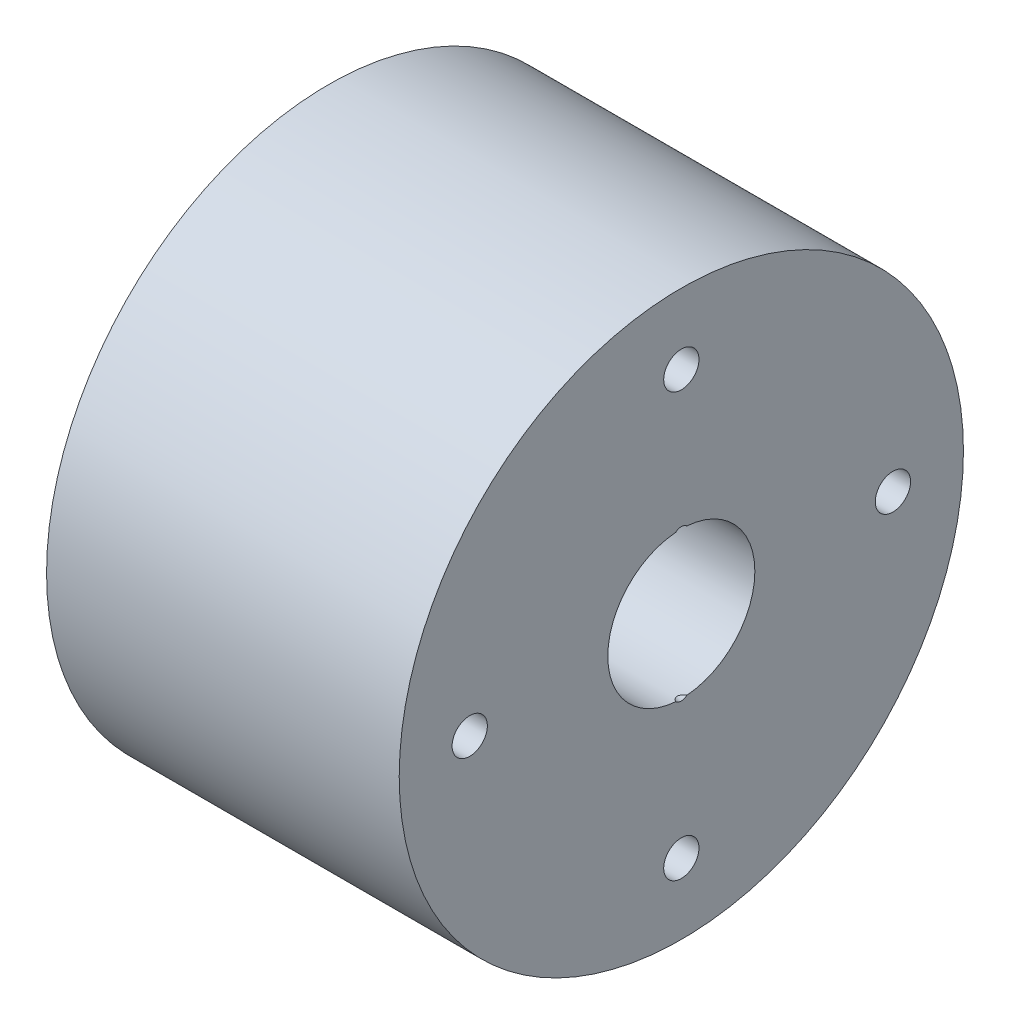
from build123d import *

# Parameters (mm, degrees)
SKETCH1_R                                  = 40
BOSS_EXTRUDE1_DEPTH                        = 50
SKETCH2_R                                  = 10.425
CUT_EXTRUDE1_DEPTH                         = 30
SKETCH3_R                                  = 20
SKETCH3_R_2                                = 10
CUT_EXTRUDE2_DEPTH                         = 5
SKETCH4_R                                  = 0.5
CUT_EXTRUDE3_DEPTH                         = 76.498344353
SKETCH5_R                                  = 2.5
CUT_EXTRUDE4_DEPTH                         = 76.498344353
CUT_EXTRUDE5_START                         = -49.839677
SKETCH7_R                                  = 1.25
CUT_EXTRUDE5_DEPTH                         = 50.817776
MIRROR1_START                              = -49.839677
MIRROR1_AT_THE_SECOND_PLANE_COPY_1_SKETC_R = 1.25
MIRROR1_AT_THE_SECOND_PLANE_COPY_1_DEPTH   = 50.817776


with BuildPart() as part:
    # Sketch1 → Boss-Extrude1 (new body)
    with BuildSketch(Plane(origin=(0, 0, 0), x_dir=(0, 0, -1), z_dir=(1, 0, 0))):
        Circle(SKETCH1_R)
    extrude(amount=BOSS_EXTRUDE1_DEPTH)

    # Sketch2 → Cut-Extrude1 (cut)
    with BuildSketch(Plane(origin=(50, 0, 0), x_dir=(0, 0, -1), z_dir=(1, 0, 0))):
        Circle(SKETCH2_R)
    extrude(amount=-CUT_EXTRUDE1_DEPTH, mode=Mode.SUBTRACT)

    # Sketch3 → Cut-Extrude2 (cut)
    with BuildSketch(Plane.ZY):
        Circle(SKETCH3_R)
        Circle(SKETCH3_R_2, mode=Mode.SUBTRACT)
    extrude(amount=-CUT_EXTRUDE2_DEPTH, mode=Mode.SUBTRACT)

    # Sketch4 → Cut-Extrude3 (cut, through all)
    with BuildSketch(Plane.ZY):
        Circle(SKETCH4_R)
    extrude(amount=-CUT_EXTRUDE3_DEPTH, mode=Mode.SUBTRACT)

    # Sketch5 → Cut-Extrude4 (cut, through all)
    with BuildSketch(Plane.ZY):
        with Locations((0, 30)):
            Circle(SKETCH5_R)
        with Locations((30, 0)):
            Circle(SKETCH5_R)
        with Locations((0, -30)):
            Circle(SKETCH5_R)
        with Locations((-30, 0)):
            Circle(SKETCH5_R)
    extrude(amount=-CUT_EXTRUDE4_DEPTH, mode=Mode.SUBTRACT)

    # Sketch7 → Cut-Extrude5 (cut)
    with BuildSketch(Plane(origin=(0, 0, 0), x_dir=(0, 0, 1), z_dir=(-0.9063077870366496, 0.42261826174070033, 0)).offset(CUT_EXTRUDE5_START)):
        with Locations(Location((0, 12.678547852, 0), (0, 0, 90))):
            Circle(SKETCH7_R)
    cut_extrude5 = extrude(amount=CUT_EXTRUDE5_DEPTH, mode=Mode.SUBTRACT)

    # Mirror1: Cut-Extrude5 across plane
    add(cut_extrude5.mirror(Plane.ZX), mode=Mode.SUBTRACT)

    # Mirror1 at the second plane: Cut-Extrude5 across plane
    add(cut_extrude5.mirror(Plane.XY), mode=Mode.SUBTRACT)

    # Mirror1 at the second plane copy 1 sketc → Mirror1 at the second plane copy 1 (cut)
    with BuildSketch(Plane(origin=(0, 0, 0), x_dir=(0, 0, -1), z_dir=(-0.9063077870366496, -0.42261826174070033, 0)).offset(MIRROR1_START)):
        with Locations(Location((0, 12.678547852, 0), (0, 0, 90))):
            Circle(MIRROR1_AT_THE_SECOND_PLANE_COPY_1_SKETC_R)
    extrude(amount=MIRROR1_AT_THE_SECOND_PLANE_COPY_1_DEPTH, mode=Mode.SUBTRACT)


solid = part.part
